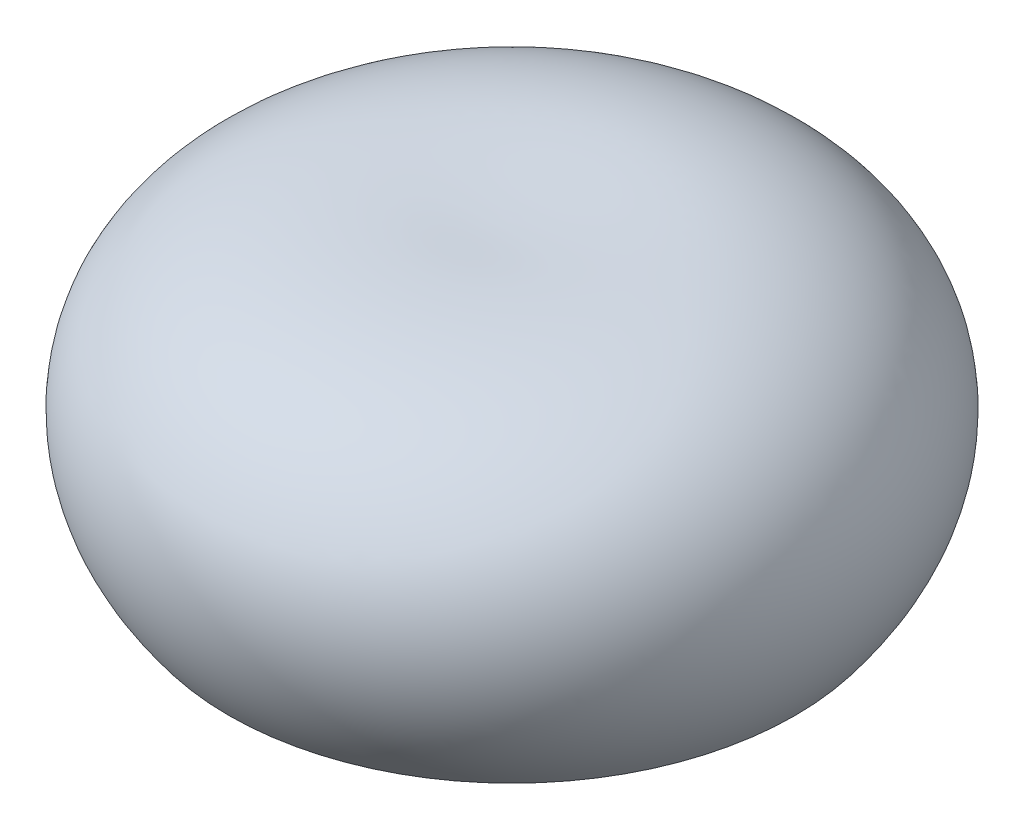
from build123d import *


with BuildPart() as part:
    # 草图1 → 旋转1 (revolve)
    with BuildSketch(Plane.XY):
        with BuildLine():
            Line((0, 7), (0, 0))
            Line((0, 0), (6.831441261, 0))
            add(Edge.make_bspline(
                [(0, 7), (0.073826027, 6.99961248), (0.178309524, 6.999064037), (0.306353289, 7.001245912), (0.380494798, 7.002863842), (0.441570297, 7.004497041), (0.495006805, 7.006121221), (0.543211062, 7.007739734), (0.587527277, 7.009349058), (0.628802834, 7.010947825), (0.667614606, 7.012534752), (0.704377034, 7.01410898), (0.739400045, 7.015669846), (0.772922733, 7.017216861), (0.805134201, 7.018749647), (0.83618711, 7.020267916), (0.866206819, 7.021771443), (0.895297775, 7.023260054), (0.923548095, 7.024733613), (0.951032931, 7.026192009), (0.977816991, 7.027635168), (1.003956462, 7.029063019), (1.029500501, 7.030475521), (1.054492406, 7.031872635), (1.078970545, 7.033254337), (1.10296911, 7.034620614), (1.126518722, 7.035971457), (1.149646932, 7.037306863), (1.172378634, 7.038626836), (1.194736407, 7.039931383), (1.216740809, 7.041220517), (1.238410615, 7.042494251), (1.25976303, 7.0437526), (1.280813862, 7.044995589), (1.301577678, 7.046223234), (1.322067936, 7.047435562), (1.342297094, 7.048632594), (1.362276717, 7.049814357), (1.382017559, 7.050980881), (1.401529643, 7.052132189), (1.420822325, 7.053268312), (1.439904357, 7.054389279), (1.458783938, 7.055495119), (1.477468763, 7.056585861), (1.495966064, 7.057661539), (1.514282646, 7.058722181), (1.532424926, 7.059767819), (1.550398957, 7.060798482), (1.568210462, 7.061814207), (1.585864853, 7.062815017), (1.603367259, 7.063800952), (1.62072254, 7.064772037), (1.637935314, 7.065728308), (1.655009966, 7.066669794), (1.671950667, 7.067596524), (1.68876139, 7.068508536), (1.705445919, 7.069405855), (1.722007866, 7.070288514), (1.738450677, 7.071156547), (1.754777643, 7.072009978), (1.770991912, 7.072848845), (1.787096497, 7.073673172), (1.803094282, 7.074482995), (1.81898803, 7.075278339), (1.834780391, 7.076059237), (1.850473907, 7.076825718), (1.86607102, 7.077577811), (1.881574075, 7.078315544), (1.896985327, 7.079038948), (1.912306943, 7.07974805), (1.927541011, 7.080442881), (1.94268954, 7.081123467), (1.957754466, 7.081789835), (1.972737654, 7.082442017), (1.987640906, 7.083080038), (2.002465956, 7.083703922), (2.017214482, 7.084313704), (2.031888102, 7.084909403), (2.046488381, 7.085491048), (2.06101683, 7.086058669), (2.075474911, 7.086612287), (2.089864039, 7.087151929), (2.104185584, 7.087677622), (2.118440871, 7.088189393), (2.132631183, 7.088687262), (2.146757765, 7.089171256), (2.160821822, 7.089641403), (2.174824525, 7.090097722), (2.188767006, 7.09054024), (2.202650367, 7.09096898), (2.216475676, 7.091383966), (2.23024397, 7.091785222), (2.243956256, 7.092172768), (2.257613513, 7.092546632), (2.271216693, 7.092906831), (2.284766719, 7.093253391), (2.298264492, 7.093586334), (2.311710885, 7.09390568), (2.32510675, 7.094211452), (2.338452915, 7.094503671), (2.351750186, 7.094782357), (2.364999348, 7.095047533), (2.378201166, 7.09529922), (2.391356385, 7.095537436), (2.404465731, 7.095762203), (2.417529911, 7.09597354), (2.430549615, 7.096171469), (2.443525516, 7.096356007), (2.45645827, 7.096527175), (2.469348518, 7.09668499), (2.482196883, 7.096829475), (2.495003975, 7.096960644), (2.50777039, 7.097078519), (2.520496708, 7.097183115), (2.533183498, 7.097274453), (2.545831313, 7.097352551), (2.558440695, 7.097417424), (2.571012173, 7.097469092), (2.583546264, 7.09750757), (2.596043474, 7.097532877), (2.608504298, 7.097545029), (2.620929218, 7.097544042), (2.633318709, 7.097529932), (2.64567323, 7.097502718), (2.657993237, 7.097462414), (2.67027917, 7.097409035), (2.682531464, 7.097342598), (2.694750544, 7.09726312), (2.706936823, 7.097170612), (2.719090708, 7.097065093), (2.731212598, 7.096946574), (2.743302883, 7.096815074), (2.755361945, 7.096670604), (2.767390158, 7.096513182), (2.779387888, 7.096342817), (2.791355496, 7.096159528), (2.803293333, 7.095963325), (2.815201745, 7.095754224), (2.827081071, 7.095532236), (2.838931641, 7.095297379), (2.850753782, 7.095049659), (2.862547814, 7.094789094), (2.874314048, 7.094515696), (2.886052794, 7.094229477), (2.89776435, 7.093930449), (2.909449014, 7.093618625), (2.921107076, 7.093294014), (2.932738821, 7.092956632), (2.944344528, 7.092606489), (2.955924471, 7.092243596), (2.967478921, 7.091867965), (2.979008141, 7.091479607), (2.990512392, 7.091078535), (3.001991929, 7.090664754), (3.013447002, 7.090238283), (3.024877857, 7.089799124), (3.036284736, 7.089347295), (3.047667878, 7.088882802), (3.059027515, 7.088405656), (3.070363877, 7.087915865), (3.081677189, 7.087413443), (3.092967672, 7.086898398), (3.104235546, 7.086370736), (3.115481023, 7.085830472), (3.126704315, 7.085277611), (3.137905628, 7.084712164), (3.149085165, 7.084134138), (3.160243127, 7.083543545), (3.171379711, 7.08294039), (3.18249511, 7.082324685), (3.193589514, 7.081696437), (3.204663111, 7.081055651), (3.215716085, 7.080402341), (3.226748617, 7.079736509), (3.237760886, 7.079058168), (3.248753066, 7.078367321), (3.25972533, 7.077663979), (3.270677849, 7.076948147), (3.28161079, 7.076219835), (3.292524317, 7.075479047), (3.303418592, 7.074725791), (3.314293774, 7.073960076), (3.325150021, 7.073181906), (3.335987487, 7.072391289), (3.346806324, 7.071588229), (3.357606682, 7.070772736), (3.368388709, 7.069944815), (3.379152549, 7.069104471), (3.389898346, 7.068251711), (3.40062624, 7.067386539), (3.411336371, 7.066508962), (3.422028874, 7.065618987), (3.432703885, 7.064716619), (3.443361536, 7.063801859), (3.454001959, 7.062874719), (3.46462528, 7.061935199), (3.475231627, 7.060983306), (3.485821126, 7.060019045), (3.496393899, 7.059042419), (3.506950067, 7.058053435), (3.51748975, 7.057052097), (3.528013066, 7.056038409), (3.53852013, 7.055012375), (3.549011057, 7.053973998), (3.559485961, 7.052923283), (3.569944951, 7.051860236), (3.580388137, 7.050784859), (3.590815628, 7.049697155), (3.60122753, 7.04859713), (3.611623946, 7.047484783), (3.622004982, 7.046360123), (3.632370739, 7.04522315), (3.642721317, 7.044073867), (3.653056816, 7.042912278), (3.663377333, 7.041738386), (3.673682964, 7.040552194), (3.683973805, 7.039353704), (3.694249949, 7.038142919), (3.704511488, 7.036919842), (3.714758514, 7.035684475), (3.724991116, 7.03443682), (3.735209383, 7.033176878), (3.745413403, 7.031904655), (3.75560326, 7.03062015), (3.765779041, 7.029323364), (3.775940829, 7.028014301), (3.786088707, 7.026692964), (3.796222756, 7.025359352), (3.806343057, 7.024013466), (3.816449688, 7.02265531), (3.826542729, 7.021284883), (3.836622256, 7.019902188), (3.846688346, 7.018507226), (3.856741073, 7.017099995), (3.866780512, 7.015680502), (3.876806735, 7.01424874), (3.886819815, 7.012804716), (3.896819824, 7.01134843), (3.90680683, 7.009879879), (3.916780903, 7.008399066), (3.926742113, 7.006905992), (3.936690524, 7.005400655), (3.946626205, 7.003883057), (3.956549222, 7.002353198), (3.966459637, 7.000811077), (3.976357517, 6.999256695), (3.986242922, 6.997690051), (3.996115917, 6.996111144), (4.005976561, 6.994519976), (4.015824916, 6.992916545), (4.02566104, 6.991300851), (4.035484994, 6.989672893), (4.045296834, 6.988032669), (4.055096619, 6.986380181), (4.064884405, 6.984715427), (4.074660248, 6.983038404), (4.084424202, 6.981349114), (4.094176323, 6.979647555), (4.103916663, 6.977933724), (4.113645276, 6.976207622), (4.123362214, 6.974469247), (4.133067528, 6.972718596), (4.142761269, 6.970955668), (4.152443487, 6.969180463), (4.162114232, 6.967392978), (4.171773552, 6.965593212), (4.181421496, 6.963781161), (4.191058111, 6.961956825), (4.200683444, 6.960120203), (4.210297541, 6.958271289), (4.219900448, 6.956410085), (4.229492209, 6.954536586), (4.239072869, 6.95265079), (4.248642473, 6.950752695), (4.258201062, 6.948842299), (4.267748681, 6.946919598), (4.277285369, 6.94498459), (4.286811171, 6.943037272), (4.296326125, 6.941077643), (4.305830272, 6.939105696), (4.315323653, 6.937121433), (4.324806306, 6.935124847), (4.334278271, 6.933115936), (4.343739584, 6.931094697), (4.353190285, 6.929061127), (4.36263041, 6.927015222), (4.372059995, 6.924956978), (4.381479078, 6.922886393), (4.390887692, 6.920803462), (4.400285874, 6.918708182), (4.409673658, 6.916600549), (4.419051079, 6.914480559), (4.42841817, 6.912348208), (4.437774964, 6.910203491), (4.447121494, 6.908046408), (4.456457791, 6.905876949), (4.465783889, 6.903695116), (4.475099817, 6.901500898), (4.484405608, 6.899294297), (4.493701291, 6.897075303), (4.502986897, 6.894843915), (4.512262455, 6.892600126), (4.521527995, 6.890343936), (4.530783544, 6.888075334), (4.540029131, 6.885794319), (4.549264784, 6.883500886), (4.55849053, 6.881195028), (4.567706398, 6.878876743), (4.576912412, 6.876546022), (4.5861086, 6.874202864), (4.595294987, 6.871847261), (4.604471599, 6.869479209), (4.61363846, 6.8670987), (4.622795596, 6.864705731), (4.63194303, 6.862300299), (4.641080787, 6.859882391), (4.65020889, 6.85745201), (4.659327362, 6.855009142), (4.668436227, 6.852553788), (4.677535505, 6.850085939), (4.686625221, 6.847605588), (4.695705394, 6.845112732), (4.704776047, 6.842607362), (4.713837201, 6.840089474), (4.722888876, 6.83755906), (4.731931092, 6.835016114), (4.740963871, 6.832460632), (4.74998723, 6.829892604), (4.75900119, 6.827312027), (4.768005769, 6.824718891), (4.777000986, 6.822113193), (4.785986859, 6.819494921), (4.794963407, 6.816864075), (4.803930647, 6.814220643), (4.812888596, 6.811564621), (4.821837272, 6.808895998), (4.830776691, 6.806214774), (4.839706869, 6.803520935), (4.848627822, 6.800814476), (4.857539568, 6.798095391), (4.866442119, 6.795363672), (4.875335493, 6.792619313), (4.884219704, 6.789862302), (4.893094767, 6.787092637), (4.901960695, 6.784310306), (4.910817504, 6.781515306), (4.919665205, 6.778707625), (4.928503814, 6.775887257), (4.937333343, 6.773054194), (4.946153805, 6.770208428), (4.954965213, 6.767349953), (4.963767579, 6.764478756), (4.972560915, 6.761594835), (4.981345232, 6.758698176), (4.990120543, 6.755788775), (4.998886858, 6.752866623), (5.007644188, 6.74993171), (5.016392546, 6.746984029), (5.025131939, 6.744023569), (5.033862379, 6.741050326), (5.042583876, 6.738064287), (5.051296439, 6.735065448), (5.060000077, 6.732053794), (5.068694801, 6.729029321), (5.077380618, 6.725992018), (5.086057538, 6.722941878), (5.094725569, 6.71987889), (5.103384718, 6.716803044), (5.112034995, 6.713714334), (5.120676405, 6.710612749), (5.129308958, 6.70749828), (5.137932659, 6.704370916), (5.146547516, 6.701230651), (5.155153537, 6.698077474), (5.163750726, 6.694911373), (5.17233909, 6.691732342), (5.180918636, 6.688540369), (5.189489369, 6.685335446), (5.198051295, 6.682117563), (5.206604418, 6.678886708), (5.215148744, 6.675642873), (5.223684278, 6.672386047), (5.232211025, 6.669116222), (5.240728988, 6.665833385), (5.249238171, 6.662537528), (5.25773858, 6.659228639), (5.266230218, 6.65590671), (5.274713087, 6.652571728), (5.283187193, 6.649223684), (5.291652536, 6.645862568), (5.300109121, 6.642488368), (5.308556949, 6.639101074), (5.316996024, 6.635700677), (5.325426348, 6.632287163), (5.333847922, 6.628860523), (5.342260749, 6.625420747), (5.350664829, 6.62196782), (5.359060165, 6.618501737), (5.367446757, 6.615022483), (5.375824607, 6.611530048), (5.384193715, 6.608024418), (5.392554082, 6.604505586), (5.400905709, 6.60097354), (5.409248594, 6.597428265), (5.417582739, 6.593869754), (5.425908142, 6.590297991), (5.434224804, 6.586712969), (5.442532724, 6.583114673), (5.450831901, 6.579503092), (5.459122334, 6.575878214), (5.467404022, 6.572240029), (5.475676964, 6.568588524), (5.483941157, 6.564923686), (5.492196599, 6.561245503), (5.50044329, 6.557553965), (5.508681226, 6.553849056), (5.516910406, 6.550130769), (5.525130826, 6.546399086), (5.533342485, 6.542653999), (5.541545379, 6.538895494), (5.549739504, 6.535123557), (5.557924857, 6.531338176), (5.566101436, 6.527539342), (5.574269235, 6.523727037), (5.582428252, 6.519901252), (5.590578482, 6.516061971), (5.598719922, 6.512209184), (5.606852565, 6.508342875), (5.61497641, 6.504463035), (5.623091449, 6.500569647), (5.631197678, 6.496662699), (5.639295091, 6.492742179), (5.647383684, 6.488808072), (5.655463452, 6.484860367), (5.663534387, 6.480899047), (5.671596486, 6.476924101), (5.679649739, 6.472935514), (5.687694144, 6.468933274), (5.695729692, 6.464917367), (5.703756377, 6.460887777), (5.711774192, 6.456844492), (5.71978313, 6.452787497), (5.727783185, 6.44871678), (5.735774348, 6.444632324), (5.743756613, 6.440534118), (5.751729971, 6.436422145), (5.759694415, 6.432296392), (5.767649937, 6.428156845), (5.775596528, 6.424003489), (5.783534181, 6.41983631), (5.791462886, 6.415655292), (5.799382636, 6.411460423), (5.807293419, 6.407251684), (5.81519523, 6.403029064), (5.823088058, 6.398792549), (5.830971892, 6.394542118), (5.838846725, 6.390277764), (5.846712546, 6.385999466), (5.854569345, 6.381707212), (5.862417112, 6.377400984), (5.870255837, 6.37308077), (5.878085509, 6.368746552), (5.885906118, 6.364398316), (5.893717654, 6.360036046), (5.901520105, 6.355659726), (5.90931346, 6.351269342), (5.917097708, 6.346864875), (5.924872839, 6.342446315), (5.932638837, 6.338013638), (5.940395695, 6.333566835), (5.948143398, 6.329105888), (5.955881936, 6.324630778), (5.963611296, 6.320141494), (5.971331465, 6.315638016), (5.97904243, 6.311120327), (5.98674418, 6.306588415), (5.994436701, 6.302042259), (6.002119979, 6.297481844), (6.009794004, 6.292907155), (6.017458758, 6.288318172), (6.02511423, 6.283714882), (6.032760407, 6.279097266), (6.040397273, 6.274465306), (6.048024816, 6.269818988), (6.05564302, 6.265158293), (6.06325187, 6.260483203), (6.070851354, 6.255793703), (6.078441456, 6.251089774), (6.08602216, 6.246371399), (6.093593452, 6.241638561), (6.101155317, 6.236891242), (6.108707739, 6.232129424), (6.116250702, 6.22735309), (6.123784191, 6.222562222), (6.13130819, 6.217756803), (6.138822681, 6.212936811), (6.146327653, 6.208102235), (6.153823082, 6.203253049), (6.161308958, 6.198389242), (6.16878526, 6.19351079), (6.176251974, 6.188617678), (6.183709081, 6.183709887), (6.191156565, 6.178787397), (6.198594407, 6.173850191), (6.206022591, 6.168898249), (6.213441098, 6.163931553), (6.220849911, 6.158950084), (6.228249012, 6.153953824), (6.235638381, 6.148942751), (6.243018001, 6.143916849), (6.250387854, 6.138876098), (6.25774792, 6.133820477), (6.26509818, 6.128749968), (6.272438616, 6.123664551), (6.279769208, 6.118564209), (6.287089935, 6.113448917), (6.294400781, 6.10831866), (6.301701724, 6.103173416), (6.308992744, 6.098013165), (6.316273821, 6.092837888), (6.323544934, 6.087647564), (6.330806063, 6.082442172), (6.33805719, 6.077221696), (6.345298289, 6.071986108), (6.352529345, 6.066735396), (6.359750331, 6.061469533), (6.36696123, 6.056188501), (6.374162017, 6.050892278), (6.381352675, 6.045580846), (6.388533176, 6.040254179), (6.395703504, 6.034912262), (6.402863633, 6.029555069), (6.410013542, 6.024182581), (6.417153208, 6.018794776), (6.424282608, 6.013391631), (6.431401721, 6.007973128), (6.438510521, 6.002539242), (6.445608988, 5.997089955), (6.452697094, 5.991625239), (6.459774821, 5.98614508), (6.466842141, 5.980649449), (6.473899031, 5.975138327), (6.480945468, 5.969611692), (6.487981427, 5.964069521), (6.495006884, 5.95851179), (6.502021813, 5.95293848), (6.50902619, 5.947349564), (6.51601999, 5.941745023), (6.523003188, 5.936124831), (6.529975758, 5.930488968), (6.536937674, 5.924837409), (6.543888912, 5.91917013), (6.550829444, 5.91348711), (6.557759247, 5.907788324), (6.56467829, 5.902073748), (6.57158655, 5.896343361), (6.578483999, 5.890597136), (6.585370611, 5.884835051), (6.592246357, 5.879057081), (6.599111213, 5.873263203), (6.605965148, 5.867453391), (6.612808137, 5.861627622), (6.619640151, 5.855785872), (6.626461162, 5.849928114), (6.633271142, 5.844054327), (6.640070062, 5.838164483), (6.646857895, 5.832258559), (6.65363461, 5.826336527), (6.66040018, 5.820398366), (6.667154576, 5.814444048), (6.673897766, 5.808473547), (6.680629723, 5.802486841), (6.687350415, 5.7964839), (6.694059815, 5.790464702), (6.700757891, 5.784429218), (6.707444612, 5.778377424), (6.714119949, 5.772309292), (6.72078387, 5.766224797), (6.727436346, 5.760123913), (6.734077343, 5.754006611), (6.740706832, 5.747872867), (6.747324779, 5.741722653), (6.753931155, 5.735555942), (6.760525926, 5.729372706), (6.767109061, 5.72317292), (6.773680527, 5.716956554), (6.780240291, 5.710723583), (6.786788322, 5.704473979), (6.793324585, 5.698207711), (6.799849047, 5.691924755), (6.806361676, 5.685625081), (6.812862436, 5.679308661), (6.819351296, 5.672975467), (6.82582822, 5.66662547), (6.832293173, 5.660258641), (6.838746122, 5.653874952), (6.845187032, 5.647474375), (6.851615868, 5.641056878), (6.858032594, 5.634622434), (6.864437176, 5.628171013), (6.870829578, 5.621702586), (6.877209762, 5.615217122), (6.883577694, 5.608714591), (6.889933338, 5.602194965), (6.896276656, 5.595658212), (6.902607613, 5.589104304), (6.908926169, 5.582533207), (6.915232291, 5.575944892), (6.921525938, 5.569339329), (6.927807074, 5.562716486), (6.93407566, 5.556076332), (6.940331659, 5.549418835), (6.946575032, 5.542743965), (6.95280574, 5.536051689), (6.959023744, 5.529341976), (6.965229006, 5.522614794), (6.971421487, 5.515870111), (6.977601144, 5.509107892), (6.983767942, 5.502328109), (6.989921836, 5.495530725), (6.996062789, 5.488715709), (7.00219076, 5.481883029), (7.008305706, 5.47503265), (7.014407587, 5.468164539), (7.020496364, 5.461278663), (7.026571991, 5.454374986), (7.03263443, 5.447453477), (7.038683638, 5.440514101), (7.04471957, 5.433556822), (7.050742184, 5.426581606), (7.056751441, 5.41958842), (7.062747294, 5.412577226), (7.0687297, 5.405547991), (7.074698615, 5.398500679), (7.080653997, 5.391435254), (7.086595799, 5.384351681), (7.092523978, 5.377249924), (7.09843849, 5.370129945), (7.104339288, 5.36299171), (7.110226328, 5.355835181), (7.116099562, 5.348660321), (7.121958947, 5.341467093), (7.127804434, 5.33425546), (7.133635978, 5.327025384), (7.139453534, 5.319776829), (7.145257051, 5.312509755), (7.151046484, 5.305224124), (7.156821783, 5.297919898), (7.162582904, 5.29059704), (7.168329793, 5.283255507), (7.174062407, 5.275895265), (7.179780693, 5.268516269), (7.185484603, 5.261118484), (7.19117409, 5.253701868), (7.196849099, 5.246266381), (7.202509584, 5.238811984), (7.208155493, 5.231338634), (7.213786775, 5.223846292), (7.219403379, 5.216334916), (7.225005254, 5.208804466), (7.230592346, 5.201254898), (7.236164607, 5.193686173), (7.24172198, 5.186098246), (7.247264415, 5.178491076), (7.252791858, 5.17086462), (7.258304256, 5.163218835), (7.263801554, 5.155553678), (7.269283698, 5.147869105), (7.274750635, 5.140165073), (7.280202309, 5.132441536), (7.285638665, 5.124698453), (7.291059647, 5.116935776), (7.296465199, 5.109153462), (7.301855266, 5.101351464), (7.307229789, 5.093529737), (7.312588712, 5.085688236), (7.31793198, 5.077826914), (7.323259529, 5.069945724), (7.328571308, 5.062044622), (7.333867255, 5.054123557), (7.339147311, 5.046182484), (7.344411415, 5.038221353), (7.349659511, 5.03024012), (7.354891536, 5.022238732), (7.360107432, 5.014217142), (7.365307135, 5.006175301), (7.370490586, 4.99811316), (7.375657723, 4.990030668), (7.380808483, 4.981927776), (7.385942803, 4.973804433), (7.39106062, 4.965660587), (7.396161874, 4.957496189), (7.401246496, 4.949311186), (7.406314425, 4.941105526), (7.411365595, 4.932879156), (7.416399942, 4.924632025), (7.4214174, 4.916364079), (7.426417902, 4.908075264), (7.431401383, 4.899765528), (7.436367773, 4.891434813), (7.441317009, 4.883083068), (7.44624902, 4.874710235), (7.451163738, 4.866316261), (7.456061095, 4.85790109), (7.460941021, 4.849464663), (7.465803446, 4.841006925), (7.470648302, 4.832527819), (7.475475515, 4.824027287), (7.480285016, 4.815505271), (7.485076733, 4.806961712), (7.48985059, 4.79839655), (7.494606521, 4.789809729), (7.499344447, 4.781201186), (7.504064297, 4.772570863), (7.508765993, 4.763918695), (7.513449467, 4.755244626), (7.518114636, 4.74654859), (7.522761429, 4.737830527), (7.527389767, 4.729090373), (7.531999574, 4.720328065), (7.536590772, 4.71154354), (7.541163283, 4.702736733), (7.545717027, 4.693907579), (7.550251926, 4.685056012), (7.5547679, 4.676181967), (7.559264867, 4.667285378), (7.563742748, 4.658366177), (7.568201459, 4.649424296), (7.572640919, 4.640459668), (7.577061042, 4.631472224), (7.581461751, 4.622461894), (7.585842955, 4.613428609), (7.590204571, 4.604372298), (7.594546516, 4.595292891), (7.5988687, 4.586190314), (7.603171038, 4.577064496), (7.607453444, 4.567915364), (7.611715826, 4.558742845), (7.615958098, 4.549546864), (7.620180171, 4.540327347), (7.624381949, 4.531084217), (7.628563348, 4.521817399), (7.632724272, 4.512526815), (7.63686463, 4.503212389), (7.640984331, 4.493874042), (7.645083274, 4.484511694), (7.649161372, 4.475125267), (7.653218524, 4.465714678), (7.657254638, 4.45627985), (7.661269612, 4.446820696), (7.665263355, 4.437337138), (7.66923576, 4.427829089), (7.673186735, 4.418296467), (7.677116175, 4.408739186), (7.68102398, 4.39915716), (7.68491005, 4.389550304), (7.688774278, 4.379918528), (7.692616567, 4.370261746), (7.696436804, 4.360579866), (7.700234889, 4.350872801), (7.704010715, 4.341140458), (7.707764174, 4.331382747), (7.711495158, 4.321599574), (7.715203559, 4.311790846), (7.718889263, 4.301956468), (7.722552163, 4.292096345), (7.726192146, 4.28221038), (7.729809098, 4.272298475), (7.733402908, 4.262360534), (7.736973454, 4.252396454), (7.740520629, 4.242406139), (7.744044308, 4.232389483), (7.747544379, 4.222346387), (7.751020719, 4.212276746), (7.754473208, 4.202180455), (7.757901727, 4.19205741), (7.76130615, 4.181907501), (7.764686357, 4.171730623), (7.76804222, 4.161526665), (7.771373615, 4.151295518), (7.774680415, 4.14103707), (7.77796249, 4.130751209), (7.781219711, 4.120437819), (7.784451948, 4.110096786), (7.787659069, 4.099727995), (7.79084094, 4.089331325), (7.793997427, 4.07890666), (7.797128393, 4.068453878), (7.800233702, 4.057972858), (7.803313213, 4.047463476), (7.80636679, 4.036925609), (7.809394288, 4.02635913), (7.812395566, 4.015763911), (7.815370481, 4.005139825), (7.818318884, 3.99448674), (7.821240631, 3.983804525), (7.824135572, 3.973093046), (7.827003555, 3.962352168), (7.829844432, 3.951581755), (7.832658048, 3.940781669), (7.835444246, 3.929951769), (7.838202873, 3.919091914), (7.84093377, 3.908201962), (7.843636775, 3.897281765), (7.846311728, 3.886331179), (7.848958465, 3.875350054), (7.851576822, 3.86433824), (7.854166632, 3.853295584), (7.856727724, 3.842221932), (7.859259931, 3.831117129), (7.861763079, 3.819981015), (7.864236993, 3.808813431), (7.866681497, 3.797614214), (7.869096413, 3.7863832), (7.87148156, 3.775120223), (7.873836757, 3.763825113), (7.876161817, 3.7524977), (7.878456556, 3.74113781), (7.880720784, 3.729745269), (7.882954312, 3.718319898), (7.885156942, 3.706861517), (7.887328483, 3.695369944), (7.889468735, 3.683844992), (7.891577499, 3.672286475), (7.893654571, 3.660694203), (7.895699747, 3.649067982), (7.897712819, 3.637407617), (7.899693575, 3.625712909), (7.901641805, 3.613983657), (7.903557292, 3.602219657), (7.905439817, 3.590420703), (7.907289162, 3.578586584), (7.9091051, 3.566717086), (7.910887405, 3.554811995), (7.912635851, 3.542871091), (7.914350199, 3.530894151), (7.91603022, 3.51888095), (7.917675669, 3.506831258), (7.91928631, 3.494744842), (7.920861894, 3.482621466), (7.922402172, 3.470460891), (7.923906896, 3.458262873), (7.925375808, 3.446027165), (7.92680865, 3.433753515), (7.928205158, 3.421441669), (7.92956507, 3.409091368), (7.930888111, 3.396702347), (7.93217401, 3.38427434), (7.93342249, 3.371807076), (7.934633269, 3.359300277), (7.935806061, 3.346753663), (7.936940577, 3.33416695), (7.93803652, 3.321539846), (7.939093596, 3.308872058), (7.940111499, 3.296163285), (7.941089923, 3.283413222), (7.942028554, 3.27062156), (7.942927078, 3.257787983), (7.943785171, 3.24491217), (7.944602506, 3.231993794), (7.945378752, 3.219032525), (7.946113571, 3.206028022), (7.946806622, 3.192979944), (7.947457556, 3.179887938), (7.948066016, 3.16675165), (7.948631649, 3.153570715), (7.949154083, 3.140344763), (7.949632952, 3.12707342), (7.950067874, 3.1137563), (7.950458468, 3.100393013), (7.950804339, 3.086983161), (7.951105095, 3.073526339), (7.951360327, 3.060022132), (7.951569625, 3.046470119), (7.951732574, 3.03286987), (7.95184874, 3.019220947), (7.951917698, 3.005522904), (7.951938999, 2.991775283), (7.951912198, 2.97797762), (7.951836834, 2.964129441), (7.951712443, 2.950230261), (7.951538547, 2.936279586), (7.951314664, 2.922276911), (7.951040298, 2.908221721), (7.950714946, 2.894113489), (7.950338097, 2.879951678), (7.949909224, 2.865735739), (7.949427798, 2.851465112), (7.948893271, 2.837139222), (7.948305089, 2.822757483), (7.947662685, 2.808319297), (7.946965479, 2.79382405), (7.946212881, 2.779271115), (7.945404291, 2.764659852), (7.944539088, 2.749989604), (7.943616644, 2.7352597), (7.942636317, 2.720469453), (7.941597449, 2.705618158), (7.940499368, 2.690705095), (7.939341388, 2.675729526), (7.938122804, 2.660690694), (7.936842898, 2.645587824), (7.935500935, 2.63042012), (7.934096162, 2.615186768), (7.932627806, 2.599886933), (7.931095082, 2.584519755), (7.929497177, 2.569084356), (7.927833264, 2.553579833), (7.926102496, 2.538005257), (7.924303998, 2.522359677), (7.922436881, 2.506642114), (7.920500227, 2.490851563), (7.918493099, 2.47498699), (7.91641453, 2.459047331), (7.914263532, 2.443031495), (7.912039084, 2.426938356), (7.909740147, 2.410766757), (7.90736564, 2.394515506), (7.904914466, 2.378183376), (7.902385483, 2.361769102), (7.899777529, 2.345271379), (7.897089394, 2.328688866), (7.894319846, 2.312020174), (7.891467606, 2.295263874), (7.888531363, 2.278418489), (7.885509757, 2.261482494), (7.882401395, 2.244454315), (7.879204834, 2.227332324), (7.875918587, 2.210114836), (7.872541115, 2.192800111), (7.86907083, 2.175386346), (7.865506094, 2.157871675), (7.861845206, 2.140254165), (7.858086412, 2.122531812), (7.854227894, 2.104702538), (7.850267765, 2.086764187), (7.846204078, 2.068714521), (7.842034806, 2.050551215), (7.837757848, 2.032271854), (7.833371027, 2.013873922), (7.828872075, 1.995354807), (7.824258639, 1.976711784), (7.819528268, 1.957942018), (7.814678413, 1.93904255), (7.809706418, 1.920010292), (7.804609514, 1.900842023), (7.79938481, 1.881534374), (7.794029295, 1.862083822), (7.788539812, 1.842486682), (7.782913068, 1.822739092), (7.777145613, 1.802837003), (7.771233831, 1.782776166), (7.765173932, 1.762552117), (7.758961935, 1.742160165), (7.752593661, 1.721595371), (7.746064711, 1.70085253), (7.73937045, 1.679926154), (7.732505999, 1.658810446), (7.725466197, 1.637499277), (7.718245598, 1.61598616), (7.710838434, 1.594264216), (7.70323859, 1.572326145), (7.695439582, 1.550164183), (7.68743451, 1.527770068), (7.679216032, 1.505134986), (7.670776315, 1.482249523), (7.662106992, 1.459103603), (7.653199103, 1.435686425), (7.644043042, 1.411986383), (7.634628477, 1.387990983), (7.624944284, 1.363686743), (7.614978446, 1.33905908), (7.604717954, 1.314092184), (7.594148689, 1.28876886), (7.583255271, 1.263070361), (7.572020914, 1.236976177), (7.560427217, 1.210463798), (7.548453948, 1.18350843), (7.536078766, 1.156082653), (7.52327691, 1.128156017), (7.510020795, 1.099694549), (7.496279544, 1.070660156), (7.482018409, 1.041009885), (7.467198033, 1.010695011), (7.451773557, 0.979659882), (7.43569345, 0.947840457), (7.418898027, 0.915162416), (7.401317504, 0.88153868), (7.382869392, 0.846866107), (7.363454982, 0.811020992), (7.342954436, 0.773852795), (7.321219775, 0.735175152), (7.298064541, 0.694752576), (7.273247917, 0.652279979), (7.246449153, 0.607349576), (7.217223809, 0.559393937), (7.184922391, 0.507579711), (7.148521469, 0.450584621), (7.106203239, 0.386040398), (7.053928975, 0.3085951), (6.962588145, 0.177853211), (6.88558457, 0.073425773), (6.831441261, 0)],
                knots=[0, 0, 0, 0, 0.016508251, 0.023363574, 0.028636216, 0.033091617, 0.037025983, 0.04059109, 0.04387702, 0.046942414, 0.049827967, 0.052563282, 0.055170689, 0.057667517, 0.060067538, 0.062381906, 0.064619804, 0.066788902, 0.068895681, 0.070945675, 0.072943656, 0.07489377, 0.076799649, 0.078664492, 0.080491139, 0.082282118, 0.084039697, 0.085765916, 0.087462619, 0.08913148, 0.090774023, 0.092391639, 0.093985605, 0.095557094, 0.097107186, 0.09863688, 0.1001471, 0.101638706, 0.103112495, 0.104569211, 0.10600955, 0.107434162, 0.108843656, 0.110238603, 0.111619541, 0.112986976, 0.114341384, 0.115683217, 0.117012898, 0.118330831, 0.119637397, 0.120932958, 0.122217857, 0.123492421, 0.12475696, 0.126011769, 0.127257131, 0.128493315, 0.129720577, 0.130939162, 0.132149305, 0.13335123, 0.134545153, 0.13573128, 0.136909808, 0.138080926, 0.139244818, 0.140401657, 0.141551613, 0.142694847, 0.143831516, 0.144961768, 0.14608575, 0.1472036, 0.148315453, 0.14942144, 0.150521684, 0.151616309, 0.15270543, 0.153789161, 0.154867612, 0.155940888, 0.157009093, 0.158072325, 0.159130682, 0.160184256, 0.161233138, 0.162277417, 0.163317176, 0.1643525, 0.165383468, 0.166410158, 0.167432647, 0.168451008, 0.169465312, 0.17047563, 0.17148203, 0.172484577, 0.173483335, 0.174478368, 0.175469736, 0.176457499, 0.177441714, 0.178422438, 0.179399726, 0.180373632, 0.181344207, 0.182311504, 0.183275571, 0.184236458, 0.185194213, 0.18614888, 0.187100506, 0.188049136, 0.188994811, 0.189937576, 0.19087747, 0.191814535, 0.192748809, 0.193680333, 0.194609143, 0.195535276, 0.19645877, 0.197379659, 0.198297978, 0.199213761, 0.200127042, 0.201037853, 0.201946226, 0.202852193, 0.203755784, 0.204657029, 0.205555959, 0.206452602, 0.207346986, 0.208239139, 0.209129089, 0.210016863, 0.210902486, 0.211785985, 0.212667385, 0.213546711, 0.214423987, 0.215299238, 0.216172487, 0.217043757, 0.217913071, 0.218780451, 0.219645919, 0.220509497, 0.221371207, 0.222231068, 0.223089102, 0.223945328, 0.224799767, 0.225652438, 0.22650336, 0.227352552, 0.228200033, 0.22904582, 0.229889932, 0.230732387, 0.231573202, 0.232412394, 0.23324998, 0.234085976, 0.234920399, 0.235753266, 0.236584591, 0.237414391, 0.23824268, 0.239069475, 0.23989479, 0.240718639, 0.241541037, 0.242361999, 0.243181539, 0.24399967, 0.244816406, 0.245631761, 0.246445748, 0.247258379, 0.248069669, 0.248879629, 0.249688273, 0.250495612, 0.251301659, 0.252106427, 0.252909926, 0.253712168, 0.254513166, 0.255312931, 0.256111473, 0.256908805, 0.257704937, 0.25849988, 0.259293644, 0.260086241, 0.26087768, 0.261667972, 0.262457128, 0.263245156, 0.264032068, 0.264817873, 0.265602581, 0.266386201, 0.267168742, 0.267950215, 0.268730627, 0.26950999, 0.27028831, 0.271065598, 0.271841862, 0.272617111, 0.273391353, 0.274164597, 0.274936852, 0.275708125, 0.276478425, 0.277247759, 0.278016137, 0.278783566, 0.279550053, 0.280315607, 0.281080235, 0.281843945, 0.282606744, 0.283368639, 0.284129639, 0.28488975, 0.28564898, 0.286407335, 0.287164823, 0.287921451, 0.288677225, 0.289432153, 0.290186241, 0.290939495, 0.291691923, 0.292443531, 0.293194325, 0.293944313, 0.294693499, 0.295441891, 0.296189495, 0.296936317, 0.297682363, 0.298427639, 0.29917215, 0.299915904, 0.300658906, 0.301401162, 0.302142677, 0.302883457, 0.303623508, 0.304362835, 0.305101445, 0.305839342, 0.306576532, 0.30731302, 0.308048812, 0.308783913, 0.309518328, 0.310252063, 0.310985123, 0.311717512, 0.312449236, 0.3131803, 0.313910709, 0.314640467, 0.31536958, 0.316098053, 0.316825891, 0.317553097, 0.318279677, 0.319005636, 0.319730978, 0.320455708, 0.321179831, 0.32190335, 0.322626271, 0.323348598, 0.324070336, 0.324791488, 0.32551206, 0.326232055, 0.326951478, 0.327670332, 0.328388624, 0.329106355, 0.329823532, 0.330540157, 0.331256236, 0.331971771, 0.332686767, 0.333401229, 0.334115159, 0.334828562, 0.335541443, 0.336253804, 0.33696565, 0.337676984, 0.338387811, 0.339098134, 0.339807957, 0.340517283, 0.341226117, 0.341934462, 0.342642321, 0.343349699, 0.344056599, 0.344763024, 0.345468979, 0.346174466, 0.346879489, 0.347584052, 0.348288158, 0.34899181, 0.349695012, 0.350397768, 0.351100081, 0.351801953, 0.352503389, 0.353204392, 0.353904965, 0.354605111, 0.355304834, 0.356004137, 0.356703023, 0.357401495, 0.358099556, 0.35879721, 0.35949446, 0.360191309, 0.360887759, 0.361583815, 0.362279479, 0.362974754, 0.363669643, 0.36436415, 0.365058277, 0.365752027, 0.366445403, 0.367138409, 0.367831047, 0.36852332, 0.369215231, 0.369906783, 0.370597978, 0.37128882, 0.371979312, 0.372669456, 0.373359255, 0.374048713, 0.374737831, 0.375426612, 0.37611506, 0.376803177, 0.377490966, 0.37817843, 0.378865571, 0.379552391, 0.380238895, 0.380925084, 0.381610961, 0.382296529, 0.38298179, 0.383666747, 0.384351403, 0.385035761, 0.385719822, 0.386403589, 0.387087066, 0.387770254, 0.388453157, 0.389135776, 0.389818115, 0.390500176, 0.391181961, 0.391863473, 0.392544714, 0.393225687, 0.393906395, 0.39458684, 0.395267024, 0.39594695, 0.39662662, 0.397306037, 0.397985203, 0.398664121, 0.399342793, 0.400021221, 0.400699408, 0.401377357, 0.402055069, 0.402732547, 0.403409794, 0.404086811, 0.404763602, 0.405440168, 0.406116513, 0.406792637, 0.407468544, 0.408144236, 0.408819716, 0.409494985, 0.410170046, 0.410844901, 0.411519553, 0.412194003, 0.412868255, 0.41354231, 0.414216171, 0.41488984, 0.415563319, 0.416236611, 0.416909718, 0.417582642, 0.418255385, 0.41892795, 0.419600339, 0.420272553, 0.420944597, 0.42161647, 0.422288177, 0.422959719, 0.423631098, 0.424302316, 0.424973377, 0.425644281, 0.426315032, 0.426985631, 0.42765608, 0.428326383, 0.42899654, 0.429666555, 0.430336429, 0.431006165, 0.431675764, 0.43234523, 0.433014564, 0.433683769, 0.434352845, 0.435021797, 0.435690626, 0.436359334, 0.437027923, 0.437696396, 0.438364755, 0.439033001, 0.439701138, 0.440369167, 0.44103709, 0.44170491, 0.442372628, 0.443040248, 0.443707771, 0.444375199, 0.445042534, 0.445709779, 0.446376936, 0.447044007, 0.447710995, 0.4483779, 0.449044726, 0.449711475, 0.450378149, 0.451044749, 0.451711279, 0.452377741, 0.453044136, 0.453710466, 0.454376735, 0.455042944, 0.455709095, 0.456375191, 0.457041233, 0.457707224, 0.458373167, 0.459039062, 0.459704913, 0.460370722, 0.46103649, 0.461702221, 0.462367916, 0.463033577, 0.463699207, 0.464364808, 0.465030382, 0.465695931, 0.466361458, 0.467026964, 0.467692453, 0.468357925, 0.469023384, 0.469688832, 0.47035427, 0.471019702, 0.471685129, 0.472350554, 0.473015978, 0.473681405, 0.474346836, 0.475012273, 0.47567772, 0.476343178, 0.477008649, 0.477674136, 0.478339641, 0.479005166, 0.479670714, 0.480336286, 0.481001886, 0.481667516, 0.482333177, 0.482998872, 0.483664604, 0.484330375, 0.484996187, 0.485662042, 0.486327943, 0.486993892, 0.487659892, 0.488325944, 0.488992052, 0.489658218, 0.490324443, 0.490990731, 0.491657084, 0.492323504, 0.492989993, 0.493656555, 0.494323191, 0.494989904, 0.495656696, 0.49632357, 0.496990528, 0.497657573, 0.498324707, 0.498991932, 0.499659252, 0.500326668, 0.500994183, 0.5016618, 0.502329521, 0.502997348, 0.503665285, 0.504333333, 0.505001496, 0.505669775, 0.506338174, 0.507006695, 0.50767534, 0.508344112, 0.509013014, 0.509682049, 0.510351218, 0.511020525, 0.511689972, 0.512359562, 0.513029297, 0.513699181, 0.514369215, 0.515039403, 0.515709747, 0.516380251, 0.517050916, 0.517721745, 0.518392742, 0.519063908, 0.519735248, 0.520406763, 0.521078456, 0.52175033, 0.522422388, 0.523094633, 0.523767067, 0.524439694, 0.525112516, 0.525785536, 0.526458757, 0.527132183, 0.527805815, 0.528479657, 0.529153711, 0.529827982, 0.530502471, 0.531177181, 0.531852116, 0.532527279, 0.533202673, 0.5338783, 0.534554164, 0.535230268, 0.535906615, 0.536583208, 0.53726005, 0.537937144, 0.538614493, 0.539292101, 0.539969971, 0.540648106, 0.541326508, 0.542005183, 0.542684131, 0.543363358, 0.544042865, 0.544722657, 0.545402737, 0.546083107, 0.546763772, 0.547444735, 0.548125999, 0.548807567, 0.549489443, 0.55017163, 0.550854132, 0.551536953, 0.552220095, 0.552903562, 0.553587358, 0.554271486, 0.55495595, 0.555640753, 0.5563259, 0.557011393, 0.557697236, 0.558383433, 0.559069988, 0.559756904, 0.560444185, 0.561131835, 0.561819858, 0.562508256, 0.563197035, 0.563886198, 0.564575749, 0.565265692, 0.56595603, 0.566646768, 0.567337909, 0.568029458, 0.568721418, 0.569413794, 0.570106589, 0.570799808, 0.571493455, 0.572187533, 0.572882048, 0.573577002, 0.574272401, 0.574968249, 0.575664549, 0.576361306, 0.577058525, 0.57775621, 0.578454364, 0.579152994, 0.579852102, 0.580551693, 0.581251772, 0.581952344, 0.582653412, 0.583354982, 0.584057058, 0.584759644, 0.585462746, 0.586166368, 0.586870514, 0.58757519, 0.5882804, 0.588986149, 0.589692442, 0.590399283, 0.591106678, 0.591814632, 0.592523149, 0.593232235, 0.593941895, 0.594652133, 0.595362955, 0.596074366, 0.596786371, 0.597498975, 0.598212184, 0.598926003, 0.599640438, 0.600355493, 0.601071174, 0.601787486, 0.602504436, 0.603222028, 0.603940268, 0.604659162, 0.605378715, 0.606098933, 0.606819822, 0.607541388, 0.608263636, 0.608986572, 0.609710203, 0.610434533, 0.61115957, 0.611885319, 0.612611786, 0.613338978, 0.6140669, 0.61479556, 0.615524962, 0.616255114, 0.616986021, 0.617717691, 0.61845013, 0.619183344, 0.619917339, 0.620652124, 0.621387703, 0.622124085, 0.622861275, 0.623599281, 0.624338109, 0.625077767, 0.625818261, 0.626559598, 0.627301787, 0.628044833, 0.628788745, 0.629533529, 0.630279192, 0.631025743, 0.631773189, 0.632521537, 0.633270795, 0.634020971, 0.634772072, 0.635524106, 0.636277082, 0.637031006, 0.637785888, 0.638541735, 0.639298555, 0.640056357, 0.640815149, 0.641574939, 0.642335736, 0.643097548, 0.643860385, 0.644624254, 0.645389164, 0.646155124, 0.646922144, 0.647690232, 0.648459398, 0.649229649, 0.650000997, 0.65077345, 0.651547017, 0.652321708, 0.653097533, 0.653874501, 0.654652623, 0.655431908, 0.656212365, 0.656994006, 0.657776841, 0.658560879, 0.659346131, 0.660132607, 0.660920319, 0.661709277, 0.662499491, 0.663290972, 0.664083733, 0.664877782, 0.665673133, 0.666469796, 0.667267783, 0.668067105, 0.668867774, 0.669669802, 0.670473201, 0.671277983, 0.67208416, 0.672891744, 0.673700749, 0.674511186, 0.675323068, 0.676136408, 0.67695122, 0.677767515, 0.678585309, 0.679404613, 0.680225443, 0.68104781, 0.68187173, 0.682697217, 0.683524283, 0.684352945, 0.685183217, 0.686015112, 0.686848647, 0.687683836, 0.688520694, 0.689359237, 0.690199481, 0.69104144, 0.691885132, 0.692730572, 0.693577776, 0.694426762, 0.695277545, 0.696130143, 0.696984574, 0.697840853, 0.698699, 0.699559031, 0.700420965, 0.70128482, 0.702150614, 0.703018367, 0.703888097, 0.704759824, 0.705633566, 0.706509344, 0.707387177, 0.708267086, 0.709149092, 0.710033215, 0.710919476, 0.711807896, 0.712698498, 0.713591303, 0.714486333, 0.715383612, 0.716283161, 0.717185005, 0.718089166, 0.718995668, 0.719904537, 0.720815795, 0.721729469, 0.722645583, 0.723564164, 0.724485237, 0.725408828, 0.726334966, 0.727263675, 0.728194986, 0.729128925, 0.730065521, 0.731004803, 0.7319468, 0.732891544, 0.733839062, 0.734789388, 0.735742552, 0.736698585, 0.737657521, 0.738619392, 0.739584232, 0.740552074, 0.741522955, 0.742496908, 0.743473969, 0.744454175, 0.745437564, 0.746424172, 0.747414039, 0.748407202, 0.749403704, 0.750403582, 0.75140688, 0.752413639, 0.753423901, 0.754437711, 0.755455113, 0.756476152, 0.757500875, 0.758529328, 0.759561559, 0.760597618, 0.761637555, 0.762681419, 0.763729264, 0.764781142, 0.765837108, 0.766897216, 0.767961524, 0.769030088, 0.770102968, 0.771180223, 0.772261915, 0.773348108, 0.774438865, 0.775534251, 0.776634335, 0.777739184, 0.778848869, 0.779963461, 0.781083035, 0.782207666, 0.783337431, 0.784472409, 0.785612681, 0.786758331, 0.787909442, 0.789066103, 0.790228404, 0.791396435, 0.792570292, 0.793750071, 0.794935871, 0.796127795, 0.797325948, 0.798530437, 0.799741374, 0.800958872, 0.802183049, 0.803414025, 0.804651926, 0.805896879, 0.807149016, 0.808408474, 0.809675392, 0.810949915, 0.812232194, 0.813522381, 0.814820636, 0.816127124, 0.817442016, 0.818765486, 0.820097718, 0.8214389, 0.822789227, 0.824148902, 0.825518134, 0.826897142, 0.828286152, 0.829685398, 0.831095124, 0.832515586, 0.833947046, 0.835389779, 0.836844074, 0.838310228, 0.839788554, 0.841279378, 0.84278304, 0.844299896, 0.84583032, 0.847374703, 0.848933455, 0.850507006, 0.852095808, 0.853700338, 0.855321097, 0.856958612, 0.858613442, 0.860286175, 0.861977436, 0.863687885, 0.865418223, 0.867169194, 0.868941592, 0.87073626, 0.872554101, 0.874396079, 0.876263228, 0.878156657, 0.880077562, 0.88202723, 0.884007054, 0.886018541, 0.888063331, 0.890143212, 0.892260136, 0.894416246, 0.896613899, 0.898855701, 0.901144543, 0.903483648, 0.905876625, 0.908327542, 0.910841004, 0.913422269, 0.916077374, 0.918813316, 0.921638278, 0.924561926, 0.927595825, 0.930754002, 0.934053748, 0.937516794, 0.9411711, 0.945053679, 0.94921533, 0.953729132, 0.958707135, 0.964337724, 0.970987573, 0.979600573, 1, 1, 1, 1], degree=3))
        make_face()
    revolve(axis=Axis((0, 7, 0), (0, -1, 0)))

    # 草图2 → 切除-旋转1 (revolve, cut)
    with BuildSketch(Plane.XZ):
        with BuildLine():
            Line((0, 4), (0, -4))
            ThreePointArc((0, -4), (4, 0), (0, 4))
        make_face()
    revolve(axis=Axis((0, 0, 4), (0, 0, -1)), mode=Mode.SUBTRACT)


solid = part.part
